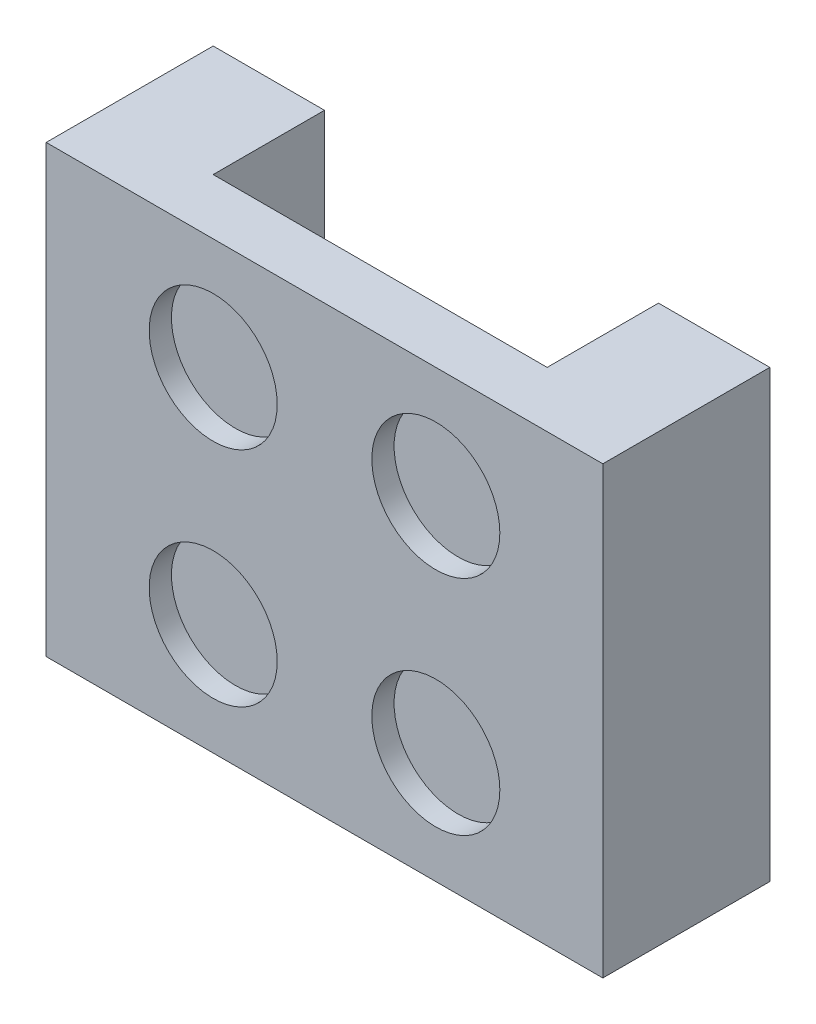
from build123d import *

# Parameters (mm, degrees)
EXTRUDE_1_DEPTH     = 40
SKETCH_2_R          = 5.75
CUT_EXTRUDE_1_DEPTH = 2


with BuildPart() as part:
    # 草图1 → 凸台-拉伸1 (new body)
    with BuildSketch(Plane(origin=(0, 0, 0), x_dir=(1, 0, 0), z_dir=(0, 1, 0))):
        Polygon((0, 0), (0, -15), (50, -15), (50, 0), (40, 0), (40, -10), (10, -10), (10, 0), align=None)
    extrude(amount=EXTRUDE_1_DEPTH)

    # 草图2 → 切除-拉伸1 (cut)
    with BuildSketch(Plane.XY.offset(15)):
        with Locations((15, 30)):
            Circle(SKETCH_2_R)
        with Locations((35, 30)):
            Circle(SKETCH_2_R)
        with Locations((15, 10)):
            Circle(SKETCH_2_R)
        with Locations((35, 10)):
            Circle(SKETCH_2_R)
    extrude(amount=-CUT_EXTRUDE_1_DEPTH, mode=Mode.SUBTRACT)


solid = part.part
